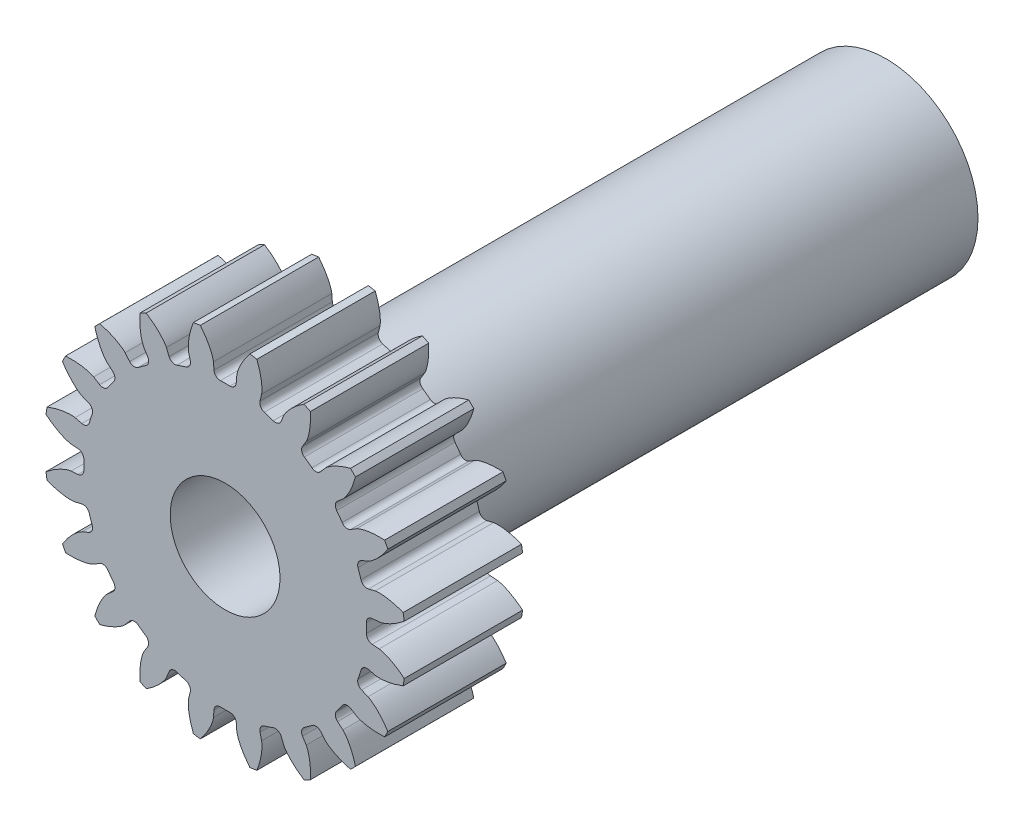
from build123d import *

# Parameters (mm, degrees)
BLANK_SKETCH_R      = 13.75
BLANK_DEPTH         = 9
TOOTH_SPACE_DEPTH   = 22.427202337
TEETH_COUNT         = 20
BORE_DEPTH          = 22.260792111
BORE_DEPTH_BACK     = 22.260792111
BORE_SKETCH_R       = 4.175
BOSS_EXTRUDE1_START = -50.25
SKETCH1_R           = 7
SKETCH1_R_2         = 4.175
BOSS_EXTRUDE1_DEPTH = 50.25


with BuildPart() as part:
    # Blank Sketch → Blank (new body)
    with BuildSketch(Plane.XY):
        Circle(BLANK_SKETCH_R)
    extrude(amount=BLANK_DEPTH)

    # Tooth Space Sketch → Tooth Space (cut, symmetric)
    with BuildSketch(Plane.XY):
        with BuildLine():
            Line((11.712575542, 0.887578892), (11.182881902, 0.847438712))
            ThreePointArc((11.182881902, 0.847438712), (10.865110495, 0.690887858), (10.744037928, 0.357979056))
            ThreePointArc((10.744037928, 0.357979056), (10.75, 0), (10.744037928, -0.357979056))
            ThreePointArc((10.744037928, -0.357979056), (10.865110495, -0.690887858), (11.182881902, -0.847438712))
            Line((11.182881902, -0.847438712), (11.712575542, -0.887578892))
            add(Edge.make_bspline(
                [(11.712575542, -0.887578892), (11.718030456, -0.888084575), (11.733302224, -0.889786577), (11.762055049, -0.894123642), (11.808748116, -0.902783585), (11.867871522, -0.916136728), (11.943785045, -0.936044148), (12.032491205, -0.962883715), (12.129128281, -0.995906017), (12.233254944, -1.03560915), (12.336170252, -1.078535303), (12.437866469, -1.124417613), (12.538256203, -1.172869671), (12.658707015, -1.234774129), (12.801489519, -1.313454101), (12.965790887, -1.41181046), (13.148934646, -1.53083847), (13.331913845, -1.659992212), (13.508861665, -1.793481702), (13.683836959, -1.93555224), (13.850418726, -2.078105804), (14.019262166, -2.233337092), (14.17300458, -2.380287394), (14.340363277, -2.552637942), (14.474017151, -2.69399985), (14.607838338, -2.84630742), (14.672335873, -2.921355394), (14.70502791, -2.960093607)],
                knots=[0, 0, 0, 0, 0, 0.005376749, 0.015083688, 0.02853182, 0.046610139, 0.064854849, 0.092110525, 0.119476176, 0.146842496, 0.174208854, 0.201574956, 0.228941013, 0.256307345, 0.307035032, 0.361767352, 0.41649966, 0.471231936, 0.525964282, 0.580696615, 0.635428982, 0.690161387, 0.744893688, 0.799626082, 0.854358408, 0.909090915, 0.909090915, 0.909090915, 0.909090915, 0.909090915], degree=4))
            Line((14.70502791, -2.960093607), (14.70502791, 2.960093607))
            add(Edge.make_bspline(
                [(11.712575542, 0.887578892), (11.718030456, 0.888084575), (11.733302224, 0.889786577), (11.762055049, 0.894123642), (11.808748116, 0.902783585), (11.867871522, 0.916136728), (11.943785045, 0.936044148), (12.032491205, 0.962883715), (12.129128281, 0.995906017), (12.233254944, 1.03560915), (12.336170252, 1.078535303), (12.437866469, 1.124417613), (12.538256203, 1.172869671), (12.658707015, 1.234774129), (12.801489519, 1.313454101), (12.965790887, 1.41181046), (13.148934646, 1.53083847), (13.331913845, 1.659992212), (13.508861665, 1.793481702), (13.683836959, 1.93555224), (13.850418726, 2.078105804), (14.019262166, 2.233337092), (14.17300458, 2.380287394), (14.340363277, 2.552637942), (14.474017151, 2.69399985), (14.607838338, 2.84630742), (14.672335873, 2.921355394), (14.70502791, 2.960093607)],
                knots=[0, 0, 0, 0, 0, 0.005376749, 0.015083688, 0.02853182, 0.046610139, 0.064854849, 0.092110525, 0.119476176, 0.146842496, 0.174208854, 0.201574956, 0.228941013, 0.256307345, 0.307035032, 0.361767352, 0.41649966, 0.471231936, 0.525964282, 0.580696615, 0.635428982, 0.690161387, 0.744893688, 0.799626082, 0.854358408, 0.909090915, 0.909090915, 0.909090915, 0.909090915, 0.909090915], degree=4))
        make_face()
    tooth_space = extrude(amount=TOOTH_SPACE_DEPTH, both=True, mode=Mode.SUBTRACT)

    # Teeth: Tooth Space ×20 about axis
    teeth_axis = Axis((0, 0, -43.762507), (0, 0, 1))
    for i in range(1, TEETH_COUNT):
        add(tooth_space.rotate(teeth_axis, i * 360 / TEETH_COUNT), mode=Mode.SUBTRACT)

    # Bore Sketch → Bore (cut, two sides: drawn at the far end of the back side and taken through both)
    with BuildSketch(Plane.XY.offset(-BORE_DEPTH_BACK)):
        Circle(BORE_SKETCH_R)
    extrude(amount=BORE_DEPTH + BORE_DEPTH_BACK, mode=Mode.SUBTRACT)

    # Sketch1 → Boss-Extrude1 (add)
    with BuildSketch(Plane.XY.offset(9).offset(BOSS_EXTRUDE1_START)):
        Circle(SKETCH1_R)
        Circle(SKETCH1_R_2, mode=Mode.SUBTRACT)
    extrude(amount=BOSS_EXTRUDE1_DEPTH)


solid = part.part
